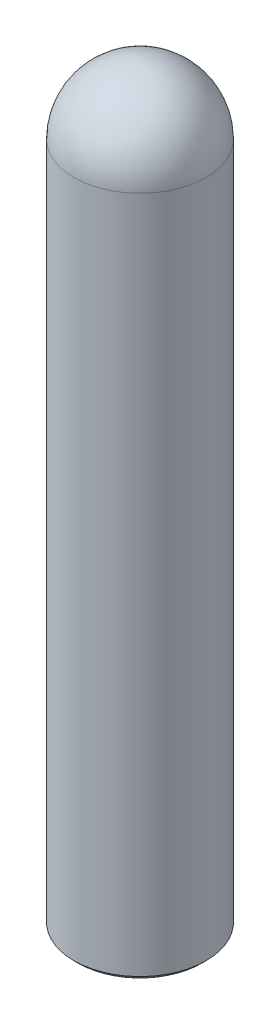
from build123d import *

# Parameters (mm, degrees)
SKETCH1_R           = 15
BOSS_EXTRUDE1_DEPTH = 170
FILLET1_R           = 15
SKETCH2_R           = 3.25
CUT_EXTRUDE1_DEPTH  = 9.6
CHAMFER1_SIZE       = 0.4
CHAMFER2_SIZE       = 1


with BuildPart() as part:
    # Sketch1 → Boss-Extrude1 (new body)
    with BuildSketch(Plane(origin=(0, 0, 0), x_dir=(1, 0, 0), z_dir=(0, 1, 0))):
        with Locations(Location((0, 0, 0), (0, 0, 270))):
            Circle(SKETCH1_R)
    extrude(amount=BOSS_EXTRUDE1_DEPTH)

    # Fillet1
    fillet1_edges = [part.edges().sort_by_distance(p)[0] for p in [
        (0, 170, -15),
    ]]
    fillet(fillet1_edges, radius=FILLET1_R)

    # Sketch2 → Cut-Extrude1 (cut)
    with BuildSketch(Plane.XZ):
        with Locations(Location((0, 0, 0), (0, 0, 270))):
            Circle(SKETCH2_R)
    extrude(amount=-CUT_EXTRUDE1_DEPTH, mode=Mode.SUBTRACT)

    # Chamfer1
    chamfer1_edges = [part.edges().sort_by_distance(p)[0] for p in [
        (0, 0, 3.25),
    ]]
    chamfer(chamfer1_edges, length=CHAMFER1_SIZE)

    # Chamfer2
    chamfer2_edges = [part.edges().sort_by_distance(p)[0] for p in [
        (0, 0, -15),
    ]]
    chamfer(chamfer2_edges, length=CHAMFER2_SIZE)


solid = part.part
